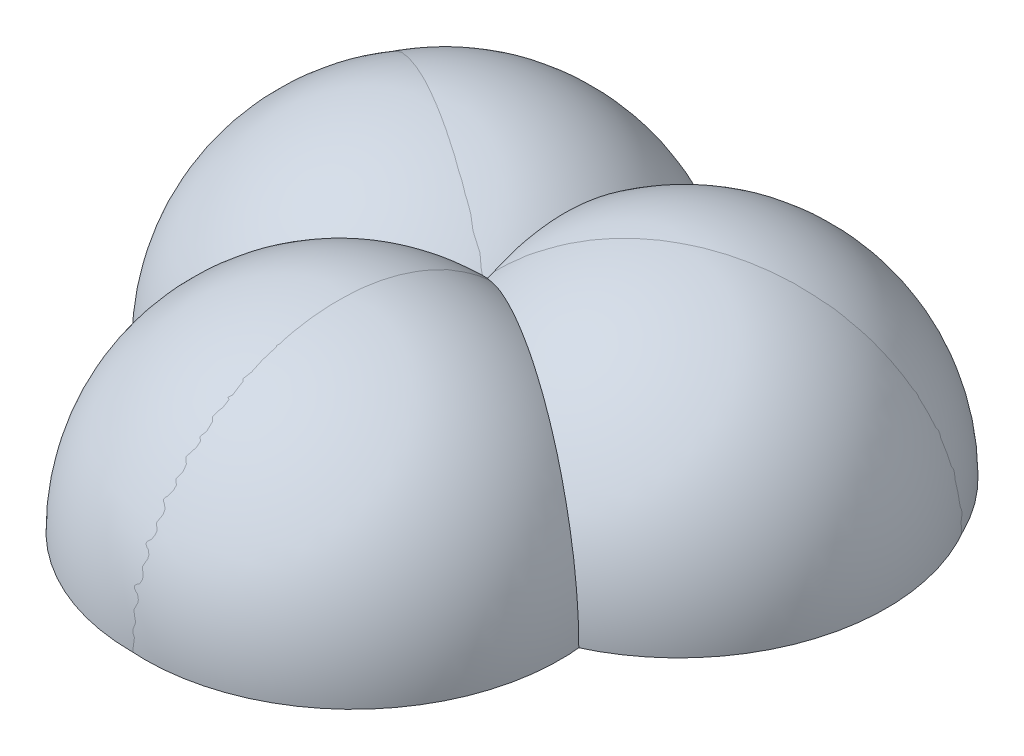
from build123d import *

# Parameters (mm, degrees)
LEG_1_REVOLVE_ANGLE = 180
LEG_2_REVOLVE_ANGLE = 180
LEG_3_REVOLVE_ANGLE = 180
LEG_4_REVOLVE_ANGLE = 180
LEG_5_REVOLVE_ANGLE = 180
LEG_6_REVOLVE_ANGLE = 180


with BuildPart() as part:
    # Sketch9 → leg 1 revolve (revolve)
    with BuildSketch(Plane(origin=(0, 0, 0), x_dir=(1, 0, 0), z_dir=(0, 1, 0))):
        with BuildLine():
            Line((-106.577162594, 188.376902507), (-106.577162594, 253.680302507))
            ThreePointArc((-106.577162594, 253.680302507), (78.715837406, 68.387302507), (-106.577162594, -116.905697493))
            Line((-106.577162594, -116.905697493), (-106.577162594, -51.602297493))
            ThreePointArc((-106.577162594, -51.602297493), (13.412437406, 68.387302507), (-106.577162594, 188.376902507))
        make_face()
    revolve(axis=Axis((-106.577162594, 0, -68.387302507), (0, 0, 1)), revolution_arc=LEG_1_REVOLVE_ANGLE)


with BuildPart() as body_2:
    # Sketch11 → leg 2 revolve (revolve)
    with BuildSketch(Plane(origin=(0, 0, 0), x_dir=(1, 0, 0), z_dir=(0, 1, 0))):
        with BuildLine():
            Line((106.546345162, 188.851739796), (106.546345162, 254.155139796))
            ThreePointArc((106.546345162, 254.155139796), (291.839345162, 68.862139796), (106.546345162, -116.430860204))
            Line((106.546345162, -116.430860204), (106.546345162, -51.127460204))
            ThreePointArc((106.546345162, -51.127460204), (226.535945162, 68.862139796), (106.546345162, 188.851739796))
        make_face()
    revolve(axis=Axis((106.546345162, 0, -68.862139796), (0, 0, 1)), revolution_arc=LEG_2_REVOLVE_ANGLE)


with BuildPart() as body_3:
    # Sketch14 → leg 3 revolve (revolve)
    with BuildSketch(Plane(origin=(0, 0, 0), x_dir=(1, 0, 0), z_dir=(0, 1, 0))):
        with BuildLine():
            Line((-5.500285777, -6.29308564), (-5.500285777, 59.01031436))
            ThreePointArc((-5.500285777, 59.01031436), (179.792714223, -126.28268564), (-5.500285777, -311.57568564))
            Line((-5.500285777, -311.57568564), (-5.500285777, -246.27228564))
            ThreePointArc((-5.500285777, -246.27228564), (114.489314223, -126.28268564), (-5.500285777, -6.29308564))
        make_face()
    revolve(axis=Axis((-5.500285777, 0, 126.28268564), (0, 0, 1)), revolution_arc=LEG_3_REVOLVE_ANGLE)


with BuildPart() as body_4:
    # Sketch15 → leg 4 revolve (revolve)
    with BuildSketch(Plane(origin=(0, 0, 0), x_dir=(1, 0, 0), z_dir=(0, 1, 0))):
        with BuildLine():
            Line((-112.909535003, 177.830371692), (-112.909535003, 243.133771692))
            ThreePointArc((-112.909535003, 243.133771692), (72.383464997, 57.840771692), (-112.909535003, -127.452228308))
            Line((-112.909535003, -127.452228308), (-112.909535003, -62.148828308))
            ThreePointArc((-112.909535003, -62.148828308), (7.080064997, 57.840771692), (-112.909535003, 177.830371692))
        make_face()
    revolve(axis=Axis((-112.909535003, 0, -57.840771692), (0, 0, 1)), revolution_arc=LEG_4_REVOLVE_ANGLE)


with BuildPart() as body_5:
    # Sketch16 → leg 5 revolve (revolve)
    with BuildSketch(Plane(origin=(0, 0, 0), x_dir=(1, 0, 0), z_dir=(0, 1, 0))):
        with BuildLine():
            Line((112.101675168, 178.366529987), (112.101675168, 243.669929987))
            ThreePointArc((112.101675168, 243.669929987), (297.394675168, 58.376929987), (112.101675168, -126.916070013))
            Line((112.101675168, -126.916070013), (112.101675168, -61.612670013))
            ThreePointArc((112.101675168, -61.612670013), (232.091275168, 58.376929987), (112.101675168, 178.366529987))
        make_face()
    revolve(axis=Axis((112.101675168, 0, -58.376929987), (0, 0, 1)), revolution_arc=LEG_5_REVOLVE_ANGLE)


with BuildPart() as body_6:
    # Sketch12 → leg 6 revolve (revolve)
    with BuildSketch(Plane(origin=(0, 0, 0), x_dir=(1, 0, 0), z_dir=(0, 1, 0))):
        with BuildLine():
            Line((6.368542399, -6.724633632), (6.368542399, 58.578766368))
            ThreePointArc((6.368542399, 58.578766368), (191.661542399, -126.714233632), (6.368542399, -312.007233632))
            Line((6.368542399, -312.007233632), (6.368542399, -246.703833632))
            ThreePointArc((6.368542399, -246.703833632), (126.358142399, -126.714233632), (6.368542399, -6.724633632))
        make_face()
    revolve(axis=Axis((6.368542399, 0, 126.714233632), (0, 0, 1)), revolution_arc=LEG_6_REVOLVE_ANGLE)


solid = Compound([part.part, body_2.part, body_3.part, body_4.part, body_5.part, body_6.part])
